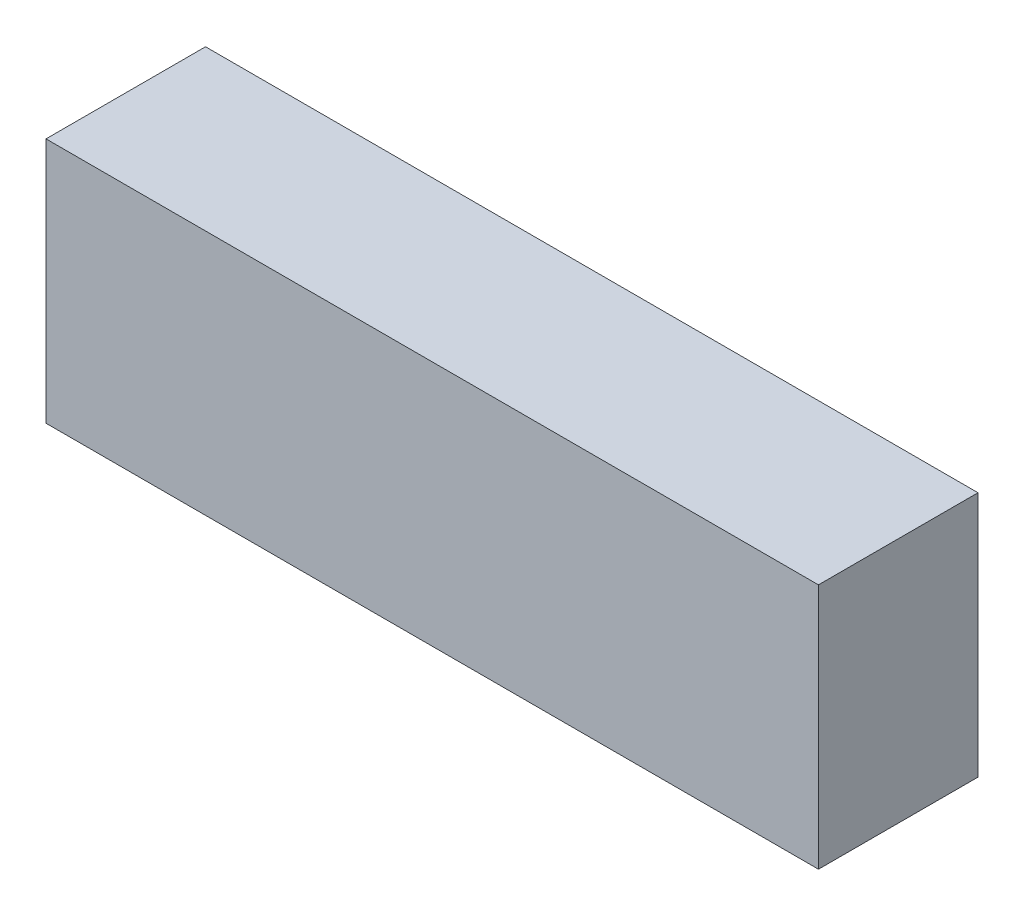
from build123d import *

# Parameters (mm, degrees)
SKETCH1_W           = 138
SKETCH1_H           = 44
BOSS_EXTRUDE1_DEPTH = 28.5


with BuildPart() as part:
    # Sketch1 → Boss-Extrude1 (new body)
    with BuildSketch(Plane.XY):
        with Locations((69, 22)):
            Rectangle(SKETCH1_W, SKETCH1_H)
    extrude(amount=BOSS_EXTRUDE1_DEPTH)


solid = part.part
